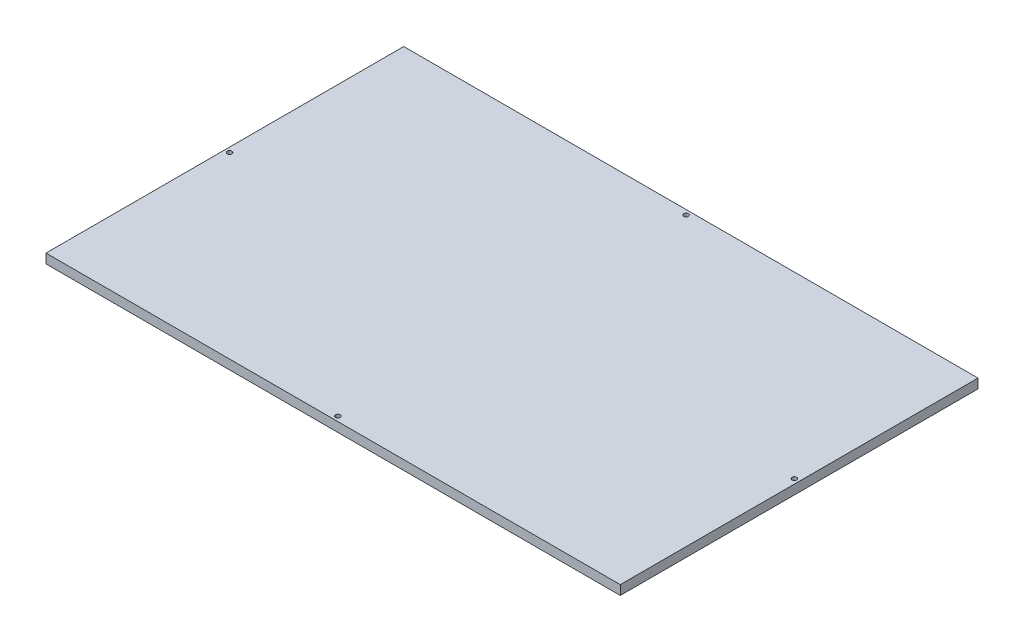
from build123d import *

# Parameters (mm, degrees)
SKETCH1_W           = 610
SKETCH1_H           = 380
BOSS_EXTRUDE1_DEPTH = 10
SKETCH2_R           = 2.5
CUT_EXTRUDE1_DEPTH  = 10


with BuildPart() as part:
    # Sketch1 → Boss-Extrude1 (new body)
    with BuildSketch(Plane(origin=(0, 0, 0), x_dir=(1, 0, 0), z_dir=(0, 1, 0))):
        Rectangle(SKETCH1_W, SKETCH1_H)
    extrude(amount=BOSS_EXTRUDE1_DEPTH)

    # Sketch2 → Cut-Extrude1 (cut)
    with BuildSketch(Plane(origin=(0, 10, 0), x_dir=(1, 0, 0), z_dir=(0, 1, 0))):
        with Locations(Location((300, 0, 0), (0, 0, 270))):
            Circle(SKETCH2_R)
        with Locations(Location((0, 185, 0), (0, 0, 270))):
            Circle(SKETCH2_R)
        with Locations(Location((-300, 0, 0), (0, 0, 270))):
            Circle(SKETCH2_R)
        with Locations(Location((0, -185, 0), (0, 0, 270))):
            Circle(SKETCH2_R)
    extrude(amount=-CUT_EXTRUDE1_DEPTH, mode=Mode.SUBTRACT)


solid = part.part
